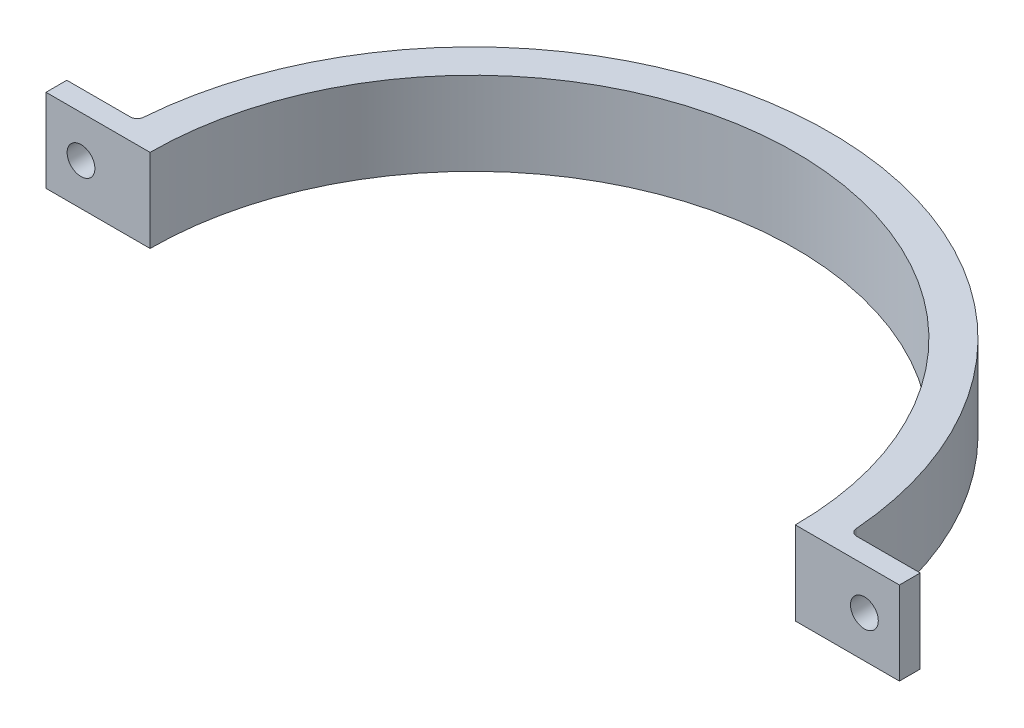
from build123d import *

# Parameters (mm, degrees)
SKETCH1_R           = 46.5
BOSS_EXTRUDE1_DEPTH = 12
SKETCH2_R           = 2
CUT_EXTRUDE1_DEPTH  = 12
SKETCH3_W           = 95
SKETCH3_H           = 5
BOSS_EXTRUDE2_DEPTH = 12
MOVE_FACE1_BY       = 3
MOVE_FACE2_BY       = 3
MOVE_FACE2_2_BY     = 3
SKETCH4_R           = 2
CUT_EXTRUDE2_DEPTH  = 114.80355882
CUT_EXTRUDE3_DEPTH  = 2
FILLET1_R           = 1
FILLET2_R           = 1


with BuildPart() as part:
    # Sketch1 → Boss-Extrude1 (new body)
    with BuildSketch(Plane(origin=(0, 0, 0), x_dir=(1, 0, 0), z_dir=(0, 1, 0))):
        with BuildLine():
            Line((61.5, -3), (61.5, 3))
            Line((61.5, 3), (51.412547107, 3))
            ThreePointArc((51.412547107, 3), (0, 51.5), (-51.412547107, 3))
            Line((-51.412547107, 3), (-61.5, 3))
            Line((-61.5, 3), (-61.5, -3))
            Line((-61.5, -3), (-51.412547107, -3))
            ThreePointArc((-51.412547107, -3), (0, -51.5), (51.412547107, -3))
            Line((51.412547107, -3), (61.5, -3))
        make_face()
        with Locations(Location((0, 0, 0), (0, 0, 270))):
            Circle(SKETCH1_R, mode=Mode.SUBTRACT)
    extrude(amount=BOSS_EXTRUDE1_DEPTH)

    # Sketch2 → Cut-Extrude1 (cut)
    with BuildSketch(Plane.XY.offset(3)):
        with Locations((56.456273553, 6)):
            Circle(SKETCH2_R)
        with Locations((-56.456273553, 6)):
            Circle(SKETCH2_R)
    extrude(amount=-CUT_EXTRUDE1_DEPTH, mode=Mode.SUBTRACT)


with BuildPart() as body_2:
    # Split1: the piece on the far side of the plane
    add(part.part)
    split(bisect_by=Plane.XY, keep=Keep.BOTTOM)

    # Fillet2
    fillet2_edges = [body_2.edges().sort_by_distance(p)[0] for p in [
        (51.412547107, 6, -3),
        (-51.412547107, 6, -3),
    ]]
    fillet(fillet2_edges, radius=FILLET2_R)


with BuildPart() as part_1:
    add(part.part)

    # Split1
    split(bisect_by=Plane.XY, keep=Keep.TOP)

    # Sketch3 → Boss-Extrude2 (add)
    with BuildSketch(Plane(origin=(0, 12, 0), x_dir=(1, 0, 0), z_dir=(0, 1, 0))):
        with Locations((0, -49)):
            Rectangle(SKETCH3_W, SKETCH3_H)
    extrude(amount=-BOSS_EXTRUDE2_DEPTH)

    # Move Face1: a face moved inward by 3.0
    extrude(part_1.faces().sort_by_distance((0, 6, 51.5))[0], amount=MOVE_FACE1_BY, dir=(0, 0, -1), mode=Mode.SUBTRACT)

    # Move Face2: a face moved outward by 3.0
    extrude(part_1.faces().sort_by_distance((34.817971811, 6, 46.5))[0], amount=MOVE_FACE2_BY, dir=(0, 0, -1))

    # Move Face2 2: a face moved outward by 3.0
    extrude(part_1.faces().sort_by_distance((-34.817971811, 6, 46.5))[0], amount=MOVE_FACE2_2_BY, dir=(0, 0, -1))

    # Sketch4 → Cut-Extrude2 (cut, through all)
    with BuildSketch(Plane(origin=(0, 0, 43.5), x_dir=(-1, 0, 0), z_dir=(0, 0, -1))):
        with Locations((44.5, 6)):
            Circle(SKETCH4_R)
    cut_extrude2 = extrude(amount=-CUT_EXTRUDE2_DEPTH, mode=Mode.SUBTRACT)

    # Sketch5 → Cut-Extrude3 (cut)
    with BuildSketch(Plane(origin=(0, 0, 43.5), x_dir=(-1, 0, 0), z_dir=(0, 0, -1))):
        with BuildLine():
            Line((47.5, 12), (42.69457877, 9.569377282))
            ThreePointArc((42.69457877, 9.569377282), (40.5, 6), (42.69457877, 2.430622718))
            Line((42.69457877, 2.430622718), (47.5, 0))
            Line((47.5, 0), (47.5, 12))
        make_face()
    cut_extrude3 = extrude(amount=-CUT_EXTRUDE3_DEPTH, mode=Mode.SUBTRACT)

    # Mirror1: Cut-Extrude2, Cut-Extrude3 across plane
    add(cut_extrude2.mirror(Plane(origin=(0, 0, 0), x_dir=(0, 0, 1), z_dir=(1, 0, 0))), mode=Mode.SUBTRACT)
    add(cut_extrude3.mirror(Plane(origin=(0, 0, 0), x_dir=(0, 0, 1), z_dir=(1, 0, 0))), mode=Mode.SUBTRACT)

    # Fillet1
    fillet1_edges = [part_1.edges().sort_by_distance(p)[0] for p in [
        (47.5, 0, 44.5),
        (47.5, 12, 44.5),
        (51.412547107, 6, 3),
        (-51.412547107, 6, 3),
        (27.568097504, 6, 43.5),
        (-47.5, 0, 44.5),
        (-27.568097504, 6, 43.5),
        (-47.5, 12, 44.5),
    ]]
    fillet(fillet1_edges, radius=FILLET1_R)


solid = body_2.part
